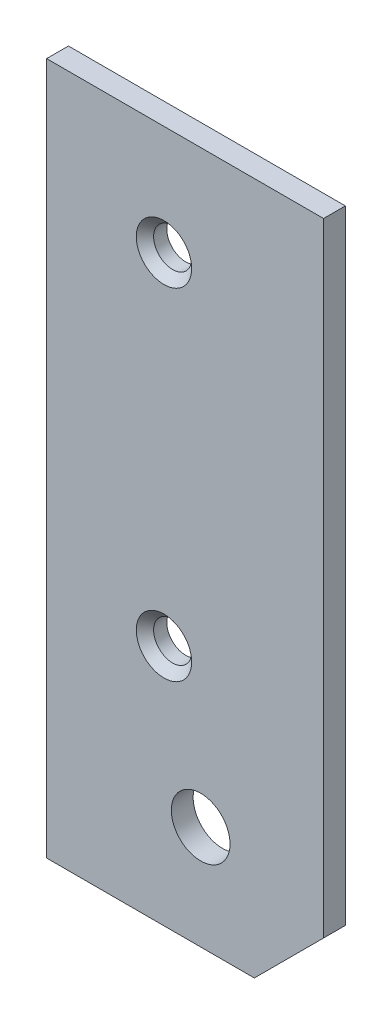
from build123d import *

# Parameters (mm, degrees)
SKETCH1_W                       = 20.32
SKETCH1_H                       = 50.8
BOSS_EXTRUDE1_DEPTH             = 1.6002
CHAMFER1_SIZE                   = 5.08
F_3_CLEARANCE_HOLE1_D           = 2.794
F_3_CLEARANCE_HOLE1_DEPTH       = 11.43
F_3_CLEARANCE_HOLE1_CSINK_D     = 4.064
F_3_CLEARANCE_HOLE1_CSINK_ANGLE = 90
F_3_CLEARANCE_HOLE1_TIP         = 0.839402285
F_8_CLEARANCE_HOLE1_D           = 4.3053


with BuildPart() as part:
    # Sketch1 → Boss-Extrude1 (new body)
    with BuildSketch(Plane.XY):
        Rectangle(SKETCH1_W, SKETCH1_H)
    extrude(amount=BOSS_EXTRUDE1_DEPTH)

    # Chamfer1
    chamfer1_edges = [part.edges().sort_by_distance(p)[0] for p in [
        (10.16, -25.4, 0.8001),
    ]]
    chamfer(chamfer1_edges, length=CHAMFER1_SIZE)

    # #3 Clearance Hole1
    with Locations(Plane(origin=(-1.5494, -7.62, 1.6002), x_dir=(1, 0, 0), z_dir=(0, 0, 1))):
        with Locations((0, 0), (0, 25)):
            CounterSinkHole(F_3_CLEARANCE_HOLE1_D / 2, F_3_CLEARANCE_HOLE1_CSINK_D / 2, depth=F_3_CLEARANCE_HOLE1_DEPTH, counter_sink_angle=F_3_CLEARANCE_HOLE1_CSINK_ANGLE)
            with Locations((0, 0, -(F_3_CLEARANCE_HOLE1_DEPTH + F_3_CLEARANCE_HOLE1_TIP / 2))):  # 118° drill point
                Cone(0, F_3_CLEARANCE_HOLE1_D / 2, F_3_CLEARANCE_HOLE1_TIP, mode=Mode.SUBTRACT)

    # #8 Clearance Hole1 (through all)
    with Locations(Plane(origin=(1.143, -17.78, 1.6002), x_dir=(1, 0, 0), z_dir=(0, 0, 1))):
        with Locations((0, 0)):
            Hole(F_8_CLEARANCE_HOLE1_D / 2)


solid = part.part
